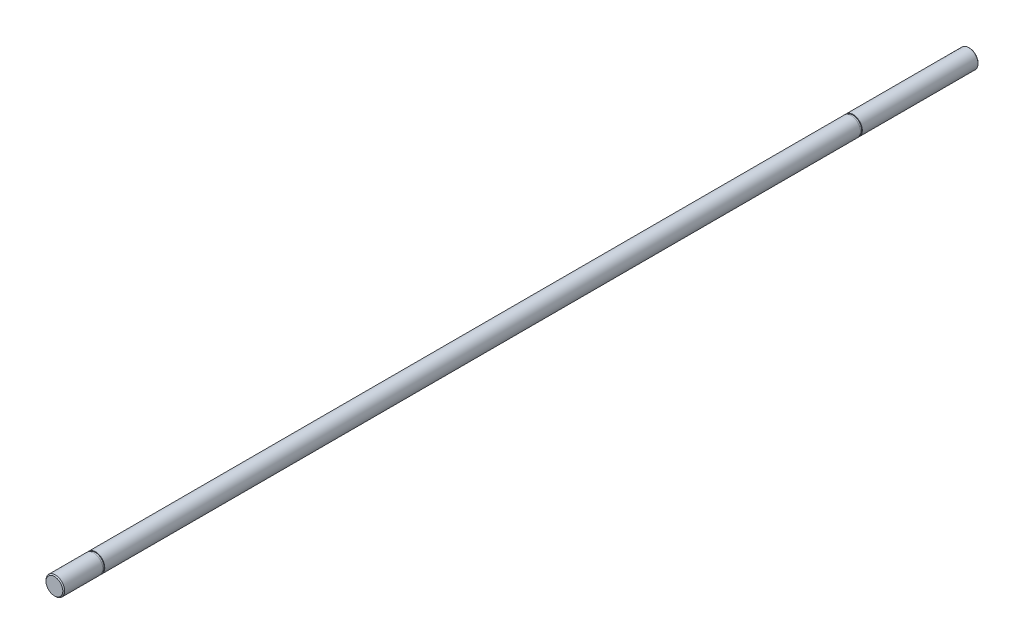
from build123d import *

# Parameters (mm, degrees)
SKETCH_1_R          = 5
EXTRUDE_1_DEPTH     = 532
SKETCH_2_W          = 3.43195358
SKETCH_2_H          = 1
SKETCH_2_W_2        = 4.632623125
CHAMFER_1_SIZE      = 0.5
SKETCH_3_W          = 38.697285924
SKETCH_3_H          = 59.202017993
CUT_EXTRUDE_1_DEPTH = 10
CHAMFER_2_SIZE      = 0.5


with BuildPart() as part:
    # 草图1 → 拉伸1 (new body)
    with BuildSketch(Plane.XY):
        Circle(SKETCH_1_R)
    extrude(amount=EXTRUDE_1_DEPTH)

    # 草图2 → 切除-旋转2 (revolve, cut)
    with BuildSketch(Plane(origin=(0, 0, 0), x_dir=(1, 0, 0), z_dir=(0, 1, 0)), mode=Mode.PRIVATE) as cut_revolve_2_sk:
        with Locations((-6.36597679, -469)):
            Rectangle(SKETCH_2_W, SKETCH_2_H)
        with Locations((-6.966311563, -63)):
            Rectangle(SKETCH_2_W_2, SKETCH_2_H)
    revolve(cut_revolve_2_sk.sketch.rotate(Axis((0, 0, 532), (0, 0, -1)), 180), axis=Axis((0, 0, 532), (0, 0, -1)), mode=Mode.SUBTRACT)

    # 倒角1
    chamfer_1_edges = [part.edges().sort_by_distance(p)[0] for p in [
        (-5, 0, 0),
        (-5, 0, 532),
    ]]
    chamfer(chamfer_1_edges, length=CHAMFER_1_SIZE)

    # 草图3 → 切除-拉伸1 (cut, symmetric)
    with BuildSketch(Plane(origin=(0, 0, 0), x_dir=(1, 0, 0), z_dir=(0, 1, 0))):
        with Locations((7.437997044, -520.101008997)):
            Rectangle(SKETCH_3_W, SKETCH_3_H)
    extrude(amount=CUT_EXTRUDE_1_DEPTH, both=True, mode=Mode.SUBTRACT)

    # 倒角2
    chamfer_2_edges = [part.edges().sort_by_distance(p)[0] for p in [
        (-5, 0, 490.5),
    ]]
    chamfer(chamfer_2_edges, length=CHAMFER_2_SIZE)


solid = part.part
